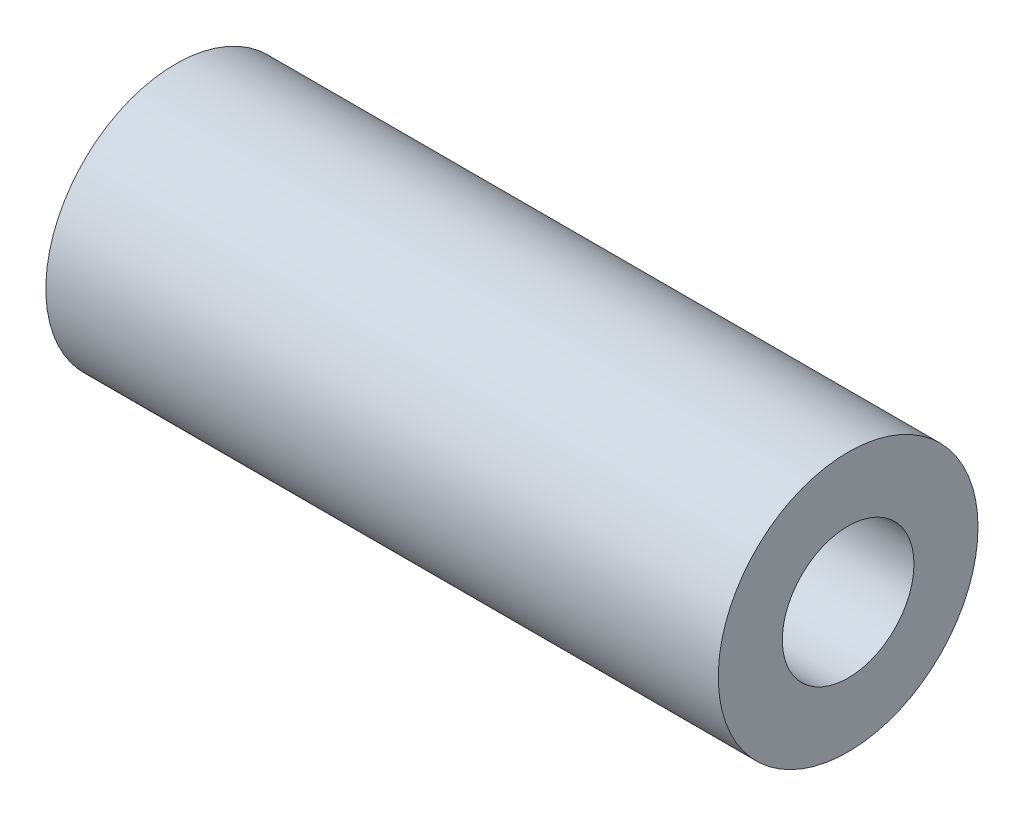
from build123d import *

# Parameters (mm, degrees)
SKETCH1_R           = 6.4389
SKETCH1_R_2         = 3.2639
BOSS_EXTRUDE1_DEPTH = 33.3375


with BuildPart() as part:
    # Sketch1 → Boss-Extrude1 (new body)
    with BuildSketch(Plane(origin=(0, 0, 0), x_dir=(0, 0, -1), z_dir=(1, 0, 0))):
        Circle(SKETCH1_R)
        Circle(SKETCH1_R_2, mode=Mode.SUBTRACT)
    extrude(amount=BOSS_EXTRUDE1_DEPTH)


solid = part.part
